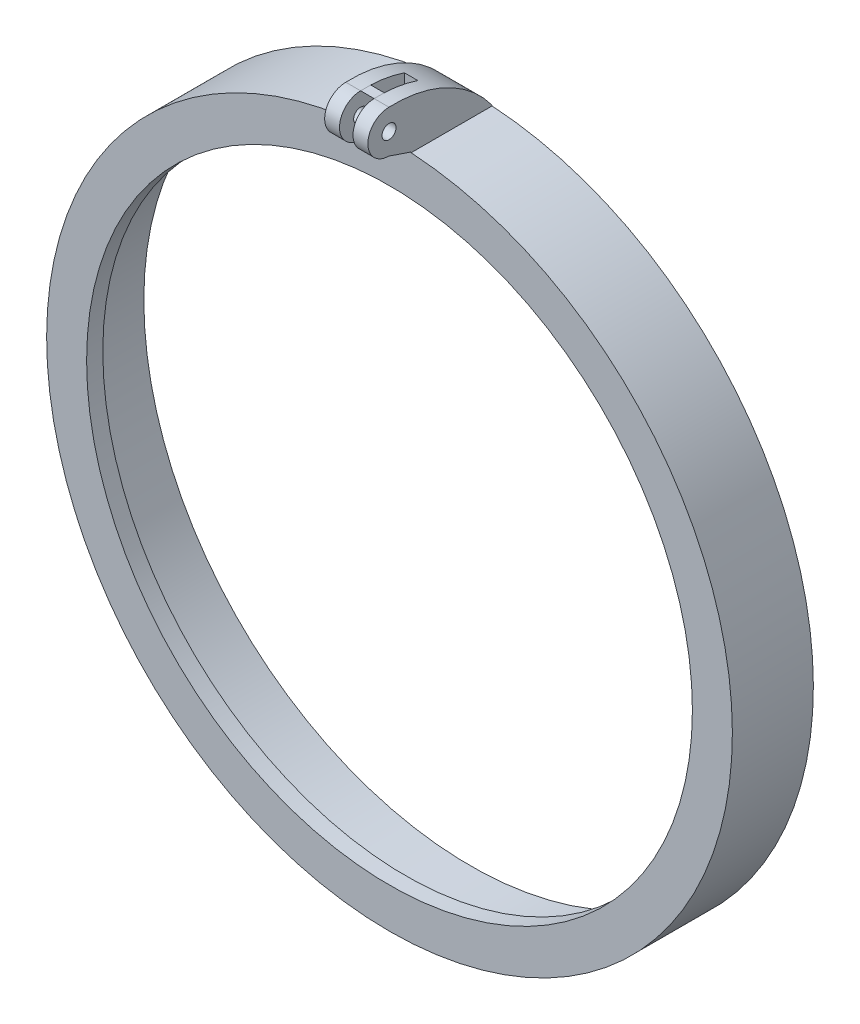
from build123d import *

# Parameters (mm, degrees)
SKETCH1_R                = 63.5
BOSS_EXTRUDE2_DEPTH      = 15
SHELL4_T                 = -3
SKETCH4_R                = 56.09702957
CUT_EXTRUDE1_DEPTH       = 22
BOSS_EXTRUDE6_DEPTH      = 4
BOSS_EXTRUDE6_DEPTH_BACK = 4
SKETCH8_R                = 1.3
BOSS_EXTRUDE7_REACH      = 145.843
BOSS_EXTRUDE7_END_RADIUS = 63.5
SKETCH9_W                = 8
SKETCH9_H                = 15
CUT_EXTRUDE2_DEPTH       = 9
CUT_EXTRUDE2_DEPTH_BACK  = 4
SKETCH10_W               = 2.5
SKETCH10_H               = 9.228481295


with BuildPart() as part:
    # Sketch1 → Boss-Extrude2 (new body)
    with BuildSketch(Plane.XY):
        Circle(SKETCH1_R)
    extrude(amount=BOSS_EXTRUDE2_DEPTH)

    # Shell4
    shell4_openings = [part.faces().sort_by_distance(p)[0] for p in [
        (0, 0, 0),
    ]]
    offset(amount=SHELL4_T, openings=shell4_openings, kind=Kind.INTERSECTION)

    # Sketch4 → Cut-Extrude1 (cut)
    with BuildSketch(Plane(origin=(0, 0, 12), x_dir=(-1, 0, 0), z_dir=(0, 0, -1))):
        Circle(SKETCH4_R)
    extrude(amount=-CUT_EXTRUDE1_DEPTH, mode=Mode.SUBTRACT)



with BuildPart() as body_2:
    # Sketch8 → Boss-Extrude6 (new, two sides: drawn at the far end of the back side and taken through both)
    with BuildSketch(Plane(origin=(0, 0, 0), x_dir=(0, 0, -1), z_dir=(1, 0, 0)).offset(-BOSS_EXTRUDE6_DEPTH_BACK)):
        with BuildLine():
            Line((-15, 63.5), (0, 63.5))
            ThreePointArc((0, 63.5), (-8.388517362, 70.509736152), (-19.092759253, 72.728481295))
            ThreePointArc((-19.092759253, 72.728481295), (-23.009560108, 68.811680441), (-19.092759253, 64.894879586))
            ThreePointArc((-19.092759253, 64.894879586), (-17.050704692, 64.184749485), (-15, 63.5))
        make_face()
        with Locations((-19.092759253, 68.811680441)):
            Circle(SKETCH8_R, mode=Mode.SUBTRACT)
    extrude(amount=BOSS_EXTRUDE6_DEPTH + BOSS_EXTRUDE6_DEPTH_BACK)


with BuildPart() as part_1:
    add(part.part)

    add(body_2.part)  # Boss-Extrude7 merges body 2
    # Boss-Extrude7: up to this cylinder (the profile starts outside it)
    boss_extrude7_end = Plane(origin=(0, 0, 7.5), z_dir=(0, 0, -1)) * Cylinder(BOSS_EXTRUDE7_END_RADIUS, 419.686, mode=Mode.PRIVATE)
    # Sketch9 → Boss-Extrude7 (add, up to the surface)
    with BuildSketch(Plane.XZ.offset(-63.5), mode=Mode.PRIVATE) as boss_extrude7_sk1:
        with Locations((0, 7.5)):
            Rectangle(SKETCH9_W, SKETCH9_H)
    boss_extrude7_tool1 = extrude(boss_extrude7_sk1.sketch, amount=BOSS_EXTRUDE7_REACH, mode=Mode.PRIVATE) - boss_extrude7_end
    add(boss_extrude7_tool1.solids().sort_by_distance((0, 63.5, 7.5))[0])
    add(boss_extrude7_tool1.solids().sort_by_distance((0, 63.5, 7.5))[1])

    # Sketch10 → Cut-Extrude2 (cut, two sides: drawn at the far end of the back side and taken through both)
    with BuildSketch(Plane.XY.offset(15).offset(-CUT_EXTRUDE2_DEPTH_BACK)):
        with Locations((0, 68.114240648)):
            Rectangle(SKETCH10_W, SKETCH10_H)
    extrude(amount=CUT_EXTRUDE2_DEPTH + CUT_EXTRUDE2_DEPTH_BACK, mode=Mode.SUBTRACT)


solid = part_1.part
